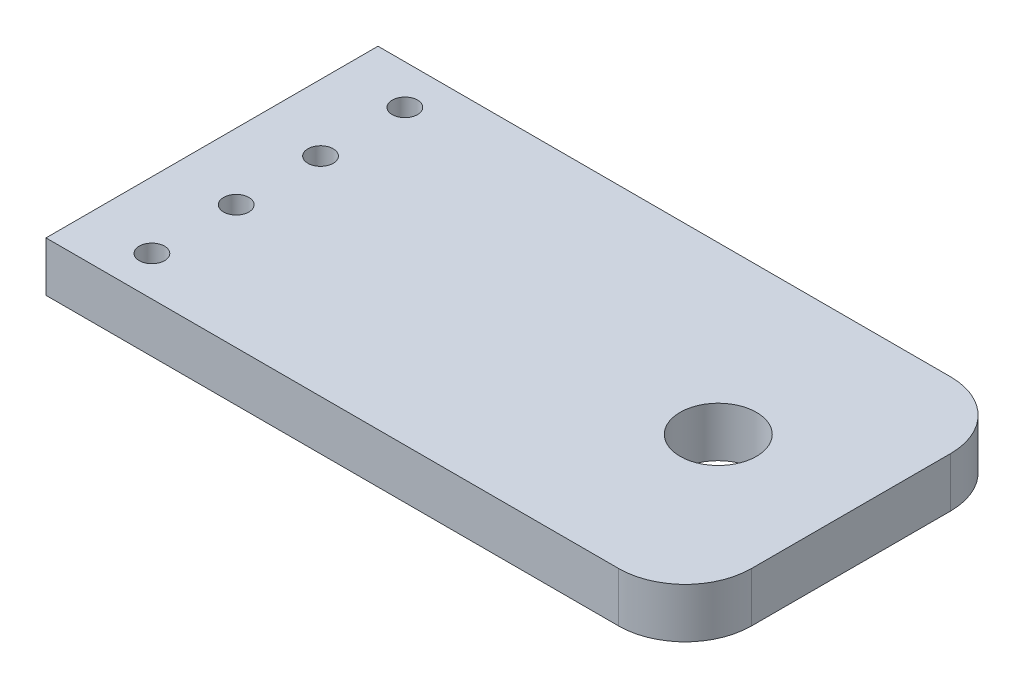
from build123d import *

# Parameters (mm, degrees)
SKETCH1_W           = 19.25
SKETCH1_H           = 10
SKETCH1_R           = 1.15
SKETCH1_R_2         = 0.381
BOSS_EXTRUDE1_DEPTH = 1.5
FILLET2_R           = 2


with BuildPart() as part:
    # Sketch1 → Boss-Extrude1 (new body)
    with BuildSketch(Plane(origin=(0, 0, 0), x_dir=(1, 0, 0), z_dir=(0, 1, 0))):
        with Locations((9.625, 5)):
            Rectangle(SKETCH1_W, SKETCH1_H)
        with Locations(Location((15.25, 5, 0), (0, 0, 270))):
            Circle(SKETCH1_R, mode=Mode.SUBTRACT)
        with Locations(Location((2, 6.27, 0), (0, 0, 270))):
            Circle(SKETCH1_R_2, mode=Mode.SUBTRACT)
        with Locations(Location((2, 3.73, 0), (0, 0, 270))):
            Circle(SKETCH1_R_2, mode=Mode.SUBTRACT)
        with Locations(Location((2, 1.19, 0), (0, 0, 270))):
            Circle(SKETCH1_R_2, mode=Mode.SUBTRACT)
        with Locations(Location((2, 8.81, 0), (0, 0, 270))):
            Circle(SKETCH1_R_2, mode=Mode.SUBTRACT)
    extrude(amount=BOSS_EXTRUDE1_DEPTH)

    # Fillet2
    fillet2_edges = [part.edges().sort_by_distance(p)[0] for p in [
        (19.25, 0.75, -10),
        (19.25, 0.75, 0),
    ]]
    fillet(fillet2_edges, radius=FILLET2_R)


solid = part.part
